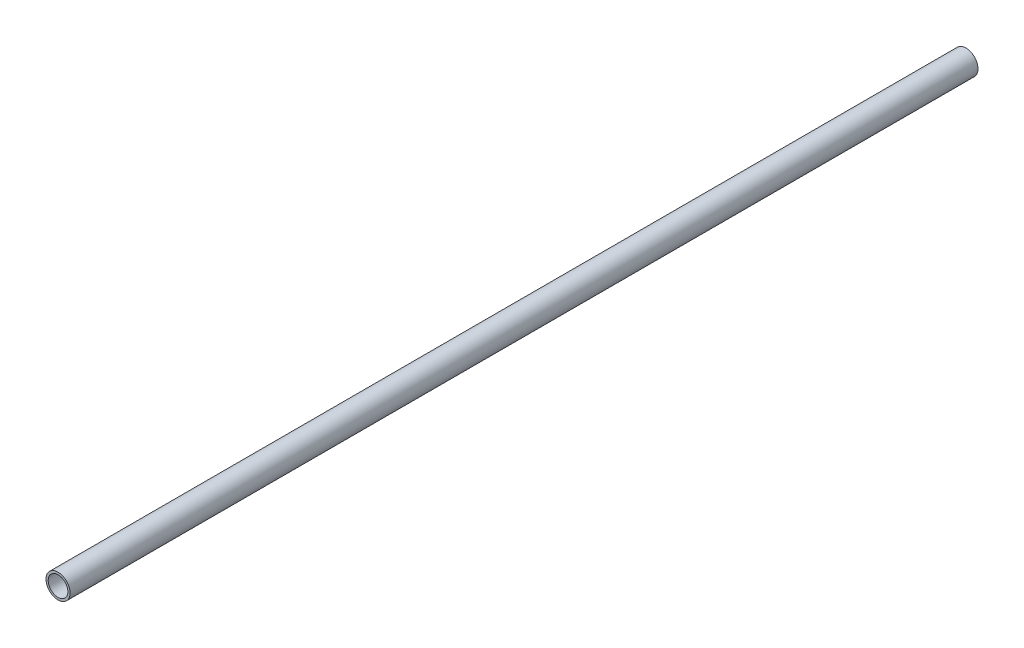
from build123d import *

# Parameters (mm, degrees)
SKETCH1_R           = 4.05
BOSS_EXTRUDE1_DEPTH = 152.5
SKETCH2_R           = 3.3
CUT_EXTRUDE1_DEPTH  = 20


with BuildPart() as part:
    # Sketch1 → Boss-Extrude1 (new, symmetric)
    with BuildSketch(Plane.XY):
        Circle(SKETCH1_R)
    extrude(amount=BOSS_EXTRUDE1_DEPTH, both=True)

    # Sketch2 → Cut-Extrude1 (cut)
    with BuildSketch(Plane.XY.offset(152.5)):
        Circle(SKETCH2_R)
    cut_extrude1 = extrude(amount=-CUT_EXTRUDE1_DEPTH, mode=Mode.SUBTRACT)

    # Mirror1: Cut-Extrude1 across plane
    add(cut_extrude1.mirror(Plane.XY), mode=Mode.SUBTRACT)


solid = part.part
